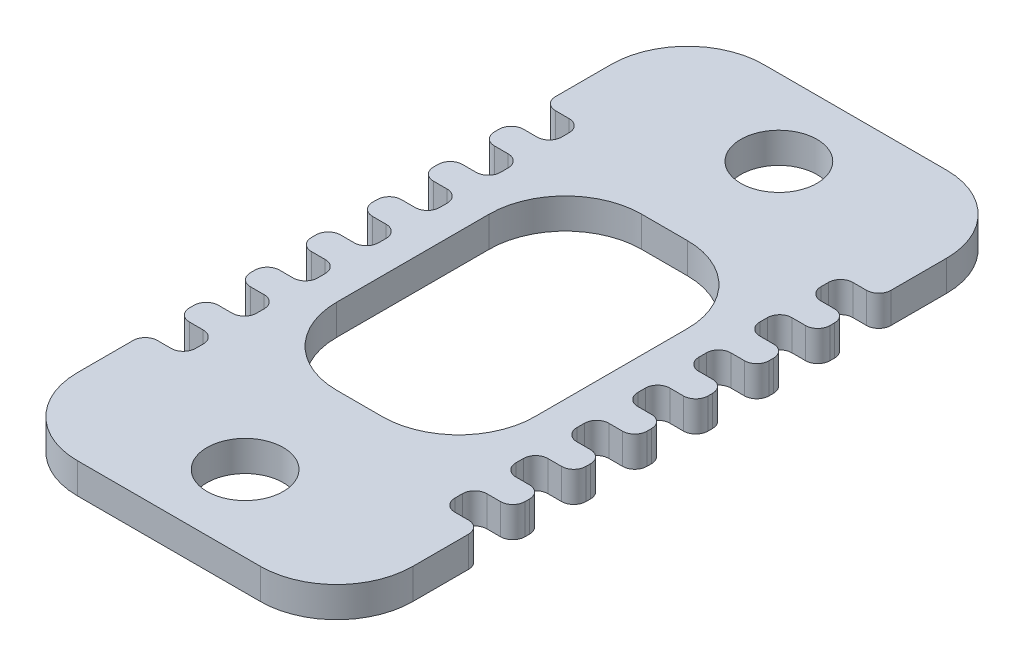
from build123d import *

# Parameters (mm, degrees)
SKETCH1_R            = 2.5
BOSS_EXTRUDE1_DEPTH  = 2
CUT_EXTRUDE1_DEPTH   = 2
LPATTERN2_COUNT      = 4
LPATTERN2_PITCH      = 4
LPATTERN2_COL_COUNT  = 4
LPATTERN2_COL_PITCH  = 4
MIRROR2_COPY_1_DEPTH = 2
MIRROR2_COPY_2_DEPTH = 2
MIRROR2_COPY_3_DEPTH = 2
MIRROR2_COPY_4_DEPTH = 2
MIRROR2_COPY_5_DEPTH = 2
MIRROR2_COPY_6_DEPTH = 2
CUT_EXTRUDE3_DEPTH   = 2


with BuildPart() as part:
    # Sketch1 → Boss-Extrude1 (new body)
    with BuildSketch(Plane(origin=(0, 0, 0), x_dir=(1, 0, 0), z_dir=(0, 1, 0))):
        with BuildLine():
            Line((-6, -22.5), (6, -22.5))
            ThreePointArc((6, -22.5), (9.535533906, -21.035533906), (11, -17.5))
            Line((11, -17.5), (11, 17.5))
            ThreePointArc((11, 17.5), (9.535533906, 21.035533906), (6, 22.5))
            Line((6, 22.5), (-6, 22.5))
            ThreePointArc((-6, 22.5), (-9.535533906, 21.035533906), (-11, 17.5))
            Line((-11, 17.5), (-11, -17.5))
            ThreePointArc((-11, -17.5), (-9.535533906, -21.035533906), (-6, -22.5))
        make_face()
        with Locations(Location((0, 17.5, 0), (0, 0, 270))):
            Circle(SKETCH1_R, mode=Mode.SUBTRACT)
        with Locations(Location((0, -17.5, 0), (0, 0, 270))):
            Circle(SKETCH1_R, mode=Mode.SUBTRACT)
    extrude(amount=BOSS_EXTRUDE1_DEPTH)

    # Sketch2 → Cut-Extrude1 (cut)
    with BuildSketch(Plane(origin=(0, 2, 0), x_dir=(1, 0, 0), z_dir=(0, 1, 0))):
        with BuildLine():
            Line((-11, -1.85), (-11, 1.85))
            ThreePointArc((-11, 1.85), (-10.765685425, 1.284314575), (-10.2, 1.05))
            Line((-10.2, 1.05), (-9.3, 1.05))
            ThreePointArc((-9.3, 1.05), (-8.734314575, 0.815685425), (-8.5, 0.25))
            Line((-8.5, 0.25), (-8.5, -0.25))
            ThreePointArc((-8.5, -0.25), (-8.734314575, -0.815685425), (-9.3, -1.05))
            Line((-9.3, -1.05), (-10.2, -1.05))
            ThreePointArc((-10.2, -1.05), (-10.765685425, -1.284314575), (-11, -1.85))
        make_face()
    cut_extrude1 = extrude(amount=-CUT_EXTRUDE1_DEPTH, mode=Mode.SUBTRACT)

    # LPattern2: Cut-Extrude1 ×4
    with Locations(*[(0, 0, i * LPATTERN2_PITCH) for i in range(1, LPATTERN2_COUNT)]):
        add(cut_extrude1, mode=Mode.SUBTRACT)

    # LPattern2 col: Cut-Extrude1 ×4
    with Locations(*[(0, 0, -i * LPATTERN2_COL_PITCH) for i in range(1, LPATTERN2_COL_COUNT)]):
        add(cut_extrude1, mode=Mode.SUBTRACT)

    # Mirror2: Cut-Extrude1 across plane
    add(cut_extrude1.mirror(Plane(origin=(0, 0, 0), x_dir=(0, 0, 1), z_dir=(1, 0, 0))), mode=Mode.SUBTRACT)

    # Mirror2 copy 1 sketch → Mirror2 copy 1 (cut)
    with BuildSketch(Plane(origin=(0, 2, 4), x_dir=(-1, 0, 0), z_dir=(0, 1, 0))):
        with BuildLine():
            Line((-11, 1.85), (-11, -1.85))
            ThreePointArc((-11, -1.85), (-10.765685425, -1.284314575), (-10.2, -1.05))
            Line((-10.2, -1.05), (-9.3, -1.05))
            ThreePointArc((-9.3, -1.05), (-8.734314575, -0.815685425), (-8.5, -0.25))
            Line((-8.5, -0.25), (-8.5, 0.25))
            ThreePointArc((-8.5, 0.25), (-8.734314575, 0.815685425), (-9.3, 1.05))
            Line((-9.3, 1.05), (-10.2, 1.05))
            ThreePointArc((-10.2, 1.05), (-10.765685425, 1.284314575), (-11, 1.85))
        make_face()
    extrude(amount=-MIRROR2_COPY_1_DEPTH, mode=Mode.SUBTRACT)

    # Mirror2 copy 2 sketch → Mirror2 copy 2 (cut)
    with BuildSketch(Plane(origin=(0, 2, 8), x_dir=(-1, 0, 0), z_dir=(0, 1, 0))):
        with BuildLine():
            Line((-11, 1.85), (-11, -1.85))
            ThreePointArc((-11, -1.85), (-10.765685425, -1.284314575), (-10.2, -1.05))
            Line((-10.2, -1.05), (-9.3, -1.05))
            ThreePointArc((-9.3, -1.05), (-8.734314575, -0.815685425), (-8.5, -0.25))
            Line((-8.5, -0.25), (-8.5, 0.25))
            ThreePointArc((-8.5, 0.25), (-8.734314575, 0.815685425), (-9.3, 1.05))
            Line((-9.3, 1.05), (-10.2, 1.05))
            ThreePointArc((-10.2, 1.05), (-10.765685425, 1.284314575), (-11, 1.85))
        make_face()
    extrude(amount=-MIRROR2_COPY_2_DEPTH, mode=Mode.SUBTRACT)

    # Mirror2 copy 3 sketch → Mirror2 copy 3 (cut)
    with BuildSketch(Plane(origin=(0, 2, 12), x_dir=(-1, 0, 0), z_dir=(0, 1, 0))):
        with BuildLine():
            Line((-11, 1.85), (-11, -1.85))
            ThreePointArc((-11, -1.85), (-10.765685425, -1.284314575), (-10.2, -1.05))
            Line((-10.2, -1.05), (-9.3, -1.05))
            ThreePointArc((-9.3, -1.05), (-8.734314575, -0.815685425), (-8.5, -0.25))
            Line((-8.5, -0.25), (-8.5, 0.25))
            ThreePointArc((-8.5, 0.25), (-8.734314575, 0.815685425), (-9.3, 1.05))
            Line((-9.3, 1.05), (-10.2, 1.05))
            ThreePointArc((-10.2, 1.05), (-10.765685425, 1.284314575), (-11, 1.85))
        make_face()
    extrude(amount=-MIRROR2_COPY_3_DEPTH, mode=Mode.SUBTRACT)

    # Mirror2 copy 4 sketch → Mirror2 copy 4 (cut)
    with BuildSketch(Plane(origin=(0, 2, -4), x_dir=(-1, 0, 0), z_dir=(0, 1, 0))):
        with BuildLine():
            Line((-11, 1.85), (-11, -1.85))
            ThreePointArc((-11, -1.85), (-10.765685425, -1.284314575), (-10.2, -1.05))
            Line((-10.2, -1.05), (-9.3, -1.05))
            ThreePointArc((-9.3, -1.05), (-8.734314575, -0.815685425), (-8.5, -0.25))
            Line((-8.5, -0.25), (-8.5, 0.25))
            ThreePointArc((-8.5, 0.25), (-8.734314575, 0.815685425), (-9.3, 1.05))
            Line((-9.3, 1.05), (-10.2, 1.05))
            ThreePointArc((-10.2, 1.05), (-10.765685425, 1.284314575), (-11, 1.85))
        make_face()
    extrude(amount=-MIRROR2_COPY_4_DEPTH, mode=Mode.SUBTRACT)

    # Mirror2 copy 5 sketch → Mirror2 copy 5 (cut)
    with BuildSketch(Plane(origin=(0, 2, -8), x_dir=(-1, 0, 0), z_dir=(0, 1, 0))):
        with BuildLine():
            Line((-11, 1.85), (-11, -1.85))
            ThreePointArc((-11, -1.85), (-10.765685425, -1.284314575), (-10.2, -1.05))
            Line((-10.2, -1.05), (-9.3, -1.05))
            ThreePointArc((-9.3, -1.05), (-8.734314575, -0.815685425), (-8.5, -0.25))
            Line((-8.5, -0.25), (-8.5, 0.25))
            ThreePointArc((-8.5, 0.25), (-8.734314575, 0.815685425), (-9.3, 1.05))
            Line((-9.3, 1.05), (-10.2, 1.05))
            ThreePointArc((-10.2, 1.05), (-10.765685425, 1.284314575), (-11, 1.85))
        make_face()
    extrude(amount=-MIRROR2_COPY_5_DEPTH, mode=Mode.SUBTRACT)

    # Mirror2 copy 6 sketch → Mirror2 copy 6 (cut)
    with BuildSketch(Plane(origin=(0, 2, -12), x_dir=(-1, 0, 0), z_dir=(0, 1, 0))):
        with BuildLine():
            Line((-11, 1.85), (-11, -1.85))
            ThreePointArc((-11, -1.85), (-10.765685425, -1.284314575), (-10.2, -1.05))
            Line((-10.2, -1.05), (-9.3, -1.05))
            ThreePointArc((-9.3, -1.05), (-8.734314575, -0.815685425), (-8.5, -0.25))
            Line((-8.5, -0.25), (-8.5, 0.25))
            ThreePointArc((-8.5, 0.25), (-8.734314575, 0.815685425), (-9.3, 1.05))
            Line((-9.3, 1.05), (-10.2, 1.05))
            ThreePointArc((-10.2, 1.05), (-10.765685425, 1.284314575), (-11, 1.85))
        make_face()
    extrude(amount=-MIRROR2_COPY_6_DEPTH, mode=Mode.SUBTRACT)

    # Sketch4 → Cut-Extrude3 (cut)
    with BuildSketch(Plane(origin=(0, 2, 0), x_dir=(1, 0, 0), z_dir=(0, 1, 0))):
        with BuildLine():
            Line((-1.5, -10), (1.5, -10))
            ThreePointArc((1.5, -10), (5.035533906, -8.535533906), (6.5, -5))
            Line((6.5, -5), (6.5, 5))
            ThreePointArc((6.5, 5), (5.035533906, 8.535533906), (1.5, 10))
            Line((1.5, 10), (-1.5, 10))
            ThreePointArc((-1.5, 10), (-5.035533906, 8.535533906), (-6.5, 5))
            Line((-6.5, 5), (-6.5, -5))
            ThreePointArc((-6.5, -5), (-5.035533906, -8.535533906), (-1.5, -10))
        make_face()
    extrude(amount=-CUT_EXTRUDE3_DEPTH, mode=Mode.SUBTRACT)


solid = part.part
